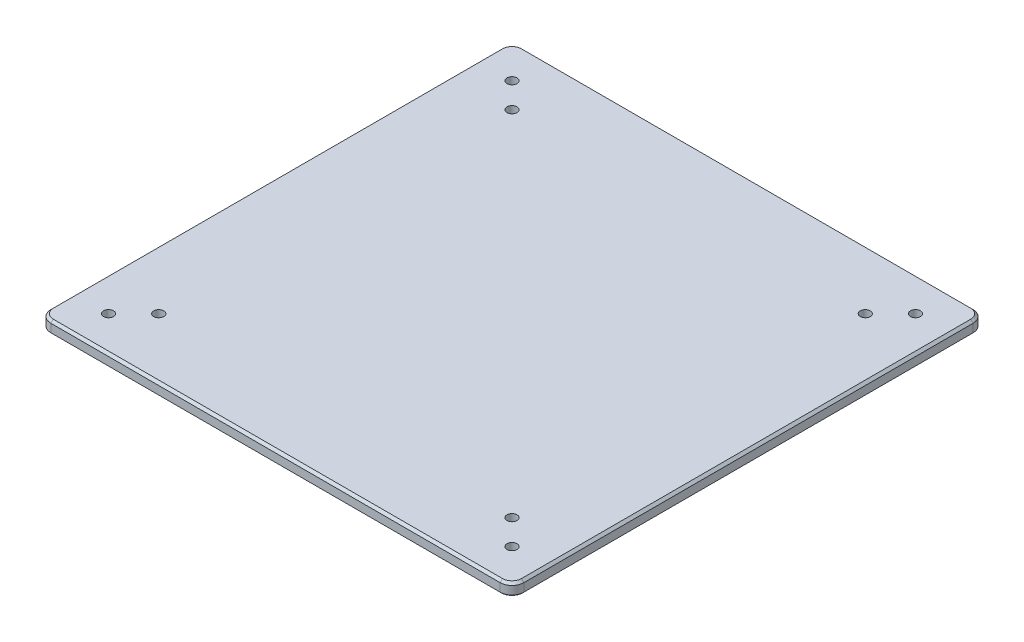
from build123d import *

# Parameters (mm, degrees)
SKETCH1_W           = 200
SKETCH1_H           = 200
BOSS_EXTRUDE1_DEPTH = 5
SKETCH2_R           = 2.125
CUT_EXTRUDE1_DEPTH  = 283.886903196
FILLET1_R           = 5
CHAMFER1_SIZE       = 1
CHAMFER2_SIZE       = 0.5


with BuildPart() as part:
    # Sketch1 → Boss-Extrude1 (new body)
    with BuildSketch(Plane(origin=(0, 0, 0), x_dir=(1, 0, 0), z_dir=(0, 1, 0))):
        with Locations((-100, -100)):
            Rectangle(SKETCH1_W, SKETCH1_H)
    extrude(amount=BOSS_EXTRUDE1_DEPTH)

    # Sketch2 → Cut-Extrude1 (cut, through all)
    with BuildSketch(Plane(origin=(0, 5, 0), x_dir=(1, 0, 0), z_dir=(0, 1, 0))):
        with Locations(Location((-185.303300859, -185.303300859, 0), (0, 0, 270))):
            Circle(SKETCH2_R)
        with Locations(Location((-174.696699141, -174.696699141, 0), (0, 0, 270))):
            Circle(SKETCH2_R)
        with Locations(Location((-185.303300859, -14.692576694, 0), (0, 0, 270))):
            Circle(SKETCH2_R)
        with Locations(Location((-174.696699141, -25.299178412, 0), (0, 0, 270))):
            Circle(SKETCH2_R)
        with Locations(Location((-14.692576694, -14.692576694, 0), (0, 0, 270))):
            Circle(SKETCH2_R)
        with Locations(Location((-25.299178412, -25.299178412, 0), (0, 0, 270))):
            Circle(SKETCH2_R)
        with Locations(Location((-14.692576694, -185.303300859, 0), (0, 0, 270))):
            Circle(SKETCH2_R)
        with Locations(Location((-25.299178412, -174.696699141, 0), (0, 0, 270))):
            Circle(SKETCH2_R)
    extrude(amount=-CUT_EXTRUDE1_DEPTH, mode=Mode.SUBTRACT)

    # Fillet1
    fillet1_edges = [part.edges().sort_by_distance(p)[0] for p in [
        (0, 2.5, 200),
        (-200, 2.5, 200),
        (-200, 2.5, 0),
        (0, 2.5, 0),
    ]]
    fillet(fillet1_edges, radius=FILLET1_R)

    # Chamfer1
    chamfer1_edges = [part.edges().sort_by_distance(p)[0] for p in [
        (-200, 5, 100),
        (-100, 5, 0),
        (0, 5, 100),
        (-100, 5, 200),
        (-198.535533906, 5, 198.535533906),
        (-1.464466094, 5, 198.535533906),
        (-1.464466094, 5, 1.464466094),
        (-198.535533906, 5, 1.464466094),
    ]]
    chamfer(chamfer1_edges, length=CHAMFER1_SIZE)

    # Chamfer2
    chamfer2_edges = [part.edges().sort_by_distance(p)[0] for p in [
        (-200, 0, 100),
        (0, 0, 100),
        (-100, 0, 200),
        (-100, 0, 0),
        (-198.535533906, 0, 198.535533906),
        (-1.464466094, 0, 198.535533906),
        (-1.464466094, 0, 1.464466094),
        (-198.535533906, 0, 1.464466094),
    ]]
    chamfer(chamfer2_edges, length=CHAMFER2_SIZE)


solid = part.part
